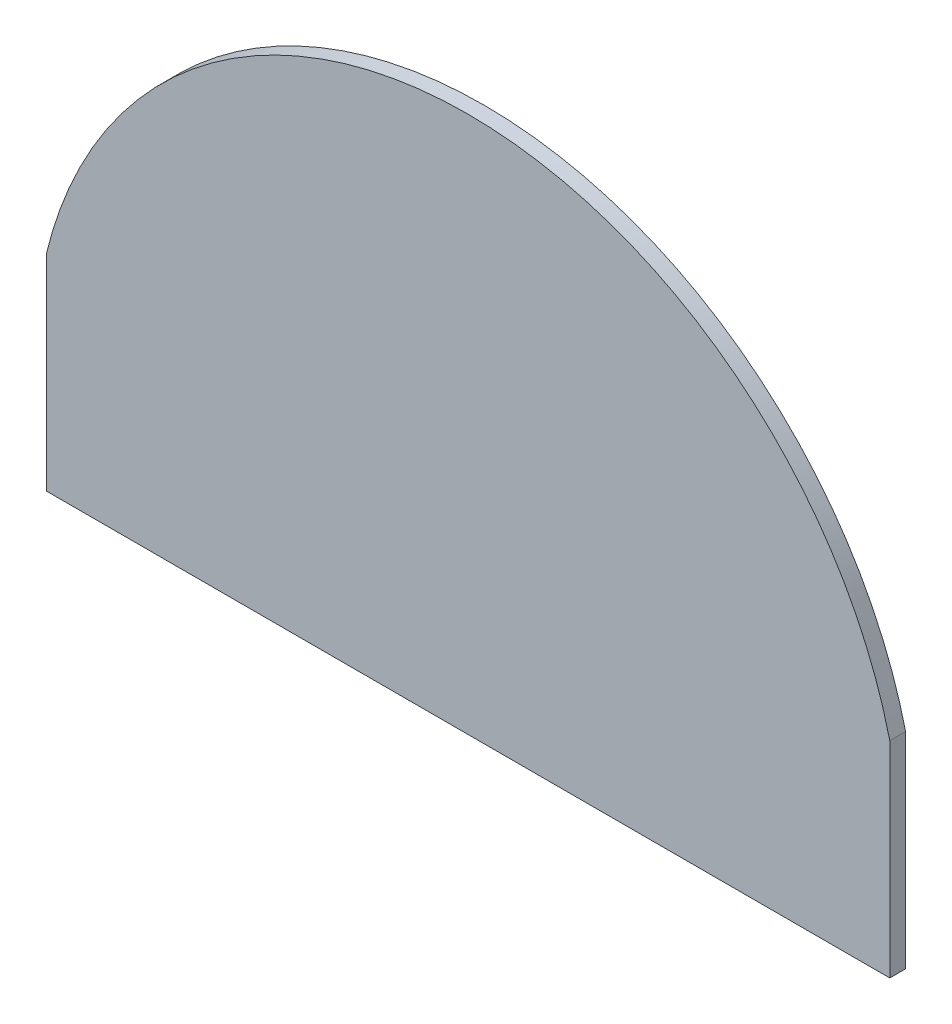
from build123d import *

# Parameters (mm, degrees)
BOSS_EXTRUDE2_DEPTH = 3


with BuildPart() as part:
    # Sketch1 → Boss-Extrude2 (new body)
    with BuildSketch(Plane.XY.offset(50)):
        with BuildLine():
            Line((-80, 44), (-80, 5))
            Line((-80, 5), (80, 5))
            Line((80, 5), (80, 44))
            add(Edge.make_bspline(
                [(80, 44), (79.185642369, 47.359524915), (78.090959871, 50.642993584), (76.996368958, 53.926187544), (75.632675663, 57.10054514), (74.269615367, 60.273429264), (72.643143273, 63.32493049), (71.018212254, 66.373540431), (69.1464912, 69.271374277), (67.277078717, 72.165633951), (65.169549811, 74.896677142), (63.065358875, 77.623394823), (60.744139477, 80.161612215), (58.427389088, 82.694942814), (55.904430358, 85.029087339), (53.387478477, 87.357674556), (50.688608551, 89.467004871), (45.456471329, 93.556237017), (39.636370091, 96.753523893), (33.599770017, 100.069744935), (27.099296795, 102.336015416), (20.564444407, 104.614271561), (13.740092778, 105.769784195), (10.333217013, 106.346643097), (6.888993887, 106.635771433), (3.448019324, 106.924627066), (0, 106.924604145), (-3.449113504, 106.924581216), (-6.888993887, 106.635771433), (-10.334302501, 106.346505901), (-13.740092778, 105.769784195), (-20.565506972, 104.613998254), (-27.099296795, 102.336015416), (-33.600766875, 100.069300743), (-39.636370091, 96.753523893), (-45.457379422, 93.555638398), (-50.688608551, 89.467004871), (-53.388306697, 87.356969911), (-55.904430358, 85.029087339), (-58.428156622, 82.694170944), (-60.744139477, 80.161612215), (-63.066061591, 77.622558826), (-65.169549811, 74.896677142), (-67.277709684, 72.164741527), (-69.1464912, 69.271374277), (-71.018767488, 66.372596198), (-72.643143273, 63.32493049), (-74.270089872, 60.272441402), (-75.632675663, 57.10054514), (-76.996759289, 53.925162142), (-78.090959871, 50.642993584), (-79.18577157, 47.358991913), (-80, 44)],
                knots=[0, 0, 0, 0.03125, 0.03125, 0.0625, 0.0625, 0.09375, 0.09375, 0.125, 0.125, 0.15625, 0.15625, 0.1875, 0.1875, 0.21875, 0.21875, 0.25, 0.25, 0.3125, 0.3125, 0.375, 0.375, 0.4375, 0.4375, 0.46875, 0.46875, 0.5, 0.5, 0.53125, 0.53125, 0.5625, 0.5625, 0.625, 0.625, 0.6875, 0.6875, 0.75, 0.75, 0.78125, 0.78125, 0.8125, 0.8125, 0.84375, 0.84375, 0.875, 0.875, 0.90625, 0.90625, 0.9375, 0.9375, 0.96875, 0.96875, 1, 1, 1], degree=2))
        make_face()
    extrude(amount=BOSS_EXTRUDE2_DEPTH)


solid = part.part
